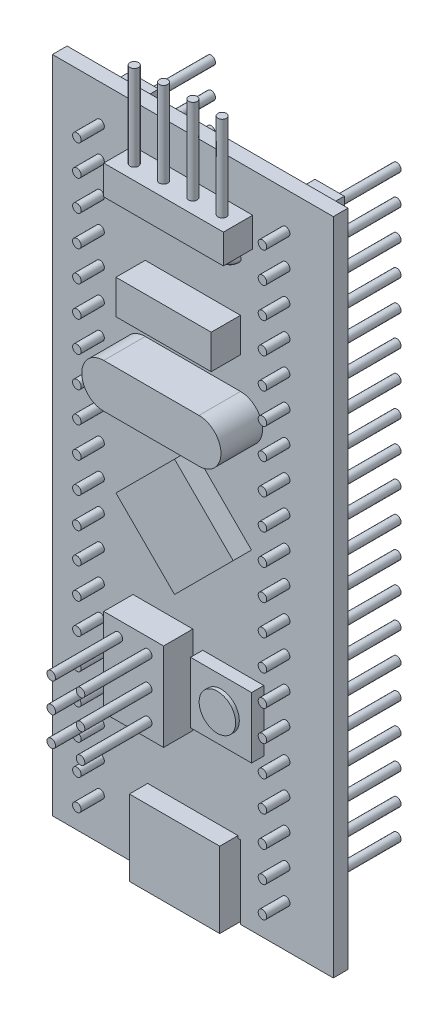
from build123d import *

# Parameters (mm, degrees)
SKETCH_1_W            = 23
SKETCH_1_H            = 54
EXTRUDE_1_DEPTH       = 1.2
SKETCH_2_W            = 2.4
SKETCH_2_H            = 50.6
EXTRUDE_2_DEPTH       = 2.4
SKETCH_3_R            = 0.35
EXTRUDE_3_DEPTH       = 5.5
SKETCH_4_W            = 9.8
SKETCH_4_H            = 2.4
SKETCH_4_W_2          = 4.9
SKETCH_4_H_2          = 7.2
SKETCH_4_W_3          = 7.8
SKETCH_4_H_3          = 2.8
EXTRUDE_4_DEPTH       = 2.4
SKETCH_5_R            = 0.35
EXTRUDE_5_DEPTH       = 7
SKETCH_6_R            = 0.35
SKETCH_7_R            = 0.35
EXTRUDE_6_DEPTH       = 5.5
SKETCH_8_W            = 7.4
SKETCH_8_H            = 6.2
EXTRUDE_7_DEPTH       = 1.5
EXTRUDE_8_DEPTH       = 3.4
SKETCH_10_W           = 5
SKETCH_10_H           = 5
EXTRUDE_9_DEPTH       = 1
SKETCH_11_R           = 1.495071924
EXTRUDE_10_DEPTH      = 0.3
CUT_EXTRUDE_1_DEPTH   = 6
IZIM1_W               = 6.9
IZIM1_H               = 1
KES_EKSTR_ZYON1_DEPTH = 5


with BuildPart() as part:
    # Эскиз1 → Бобышка-Вытянуть1 (new body)
    with BuildSketch(Plane.XY):
        with Locations((0.400091461, -3.870786517)):
            Rectangle(SKETCH_1_W, SKETCH_1_H)
    extrude(amount=EXTRUDE_1_DEPTH)

    # Эскиз2 → Бобышка-Вытянуть2 (add)
    with BuildSketch(Plane(origin=(0, 0, 0), x_dir=(-1, 0, 0), z_dir=(0, 0, -1))):
        with Locations((-8.000091461, -3.870786517)):
            Rectangle(SKETCH_2_W, SKETCH_2_H)
        with Locations((7.199908539, -3.870786517)):
            Rectangle(SKETCH_2_W, SKETCH_2_H)
    extrude(amount=EXTRUDE_2_DEPTH)

    # Эскиз3 → Бобышка-Вытянуть3 (add, symmetric)
    with BuildSketch(Plane(origin=(0, 0, -2.4), x_dir=(-1, 0, 0), z_dir=(0, 0, -1))):
        with Locations((-8.000091461, 20.132856753)):
            Circle(SKETCH_3_R)
        with Locations((7.199908539, 20.132856753)):
            Circle(SKETCH_3_R)
        with Locations((7.199908539, 17.632856753)):
            Circle(SKETCH_3_R)
        with Locations((7.199908539, 15.132856753)):
            Circle(SKETCH_3_R)
        with Locations((7.199908539, 12.632856753)):
            Circle(SKETCH_3_R)
        with Locations((7.199908539, 10.132856753)):
            Circle(SKETCH_3_R)
        with Locations((7.199908539, 7.632856753)):
            Circle(SKETCH_3_R)
        with Locations((7.199908539, 5.132856753)):
            Circle(SKETCH_3_R)
        with Locations((7.199908539, 2.632856753)):
            Circle(SKETCH_3_R)
        with Locations((7.199908539, 0.132856753)):
            Circle(SKETCH_3_R)
        with Locations((7.199908539, -2.367143247)):
            Circle(SKETCH_3_R)
        with Locations((7.199908539, -4.867143247)):
            Circle(SKETCH_3_R)
        with Locations((7.199908539, -7.367143247)):
            Circle(SKETCH_3_R)
        with Locations((7.199908539, -9.867143247)):
            Circle(SKETCH_3_R)
        with Locations((7.199908539, -12.367143247)):
            Circle(SKETCH_3_R)
        with Locations((7.199908539, -14.867143247)):
            Circle(SKETCH_3_R)
        with Locations((7.199908539, -17.367143247)):
            Circle(SKETCH_3_R)
        with Locations((7.199908539, -19.867143247)):
            Circle(SKETCH_3_R)
        with Locations((7.199908539, -22.367143247)):
            Circle(SKETCH_3_R)
        with Locations((7.199908539, -24.867143247)):
            Circle(SKETCH_3_R)
        with Locations((7.199908539, -27.367143247)):
            Circle(SKETCH_3_R)
        with Locations((-8.000091461, 17.632856753)):
            Circle(SKETCH_3_R)
        with Locations((-8.000091461, 15.132856753)):
            Circle(SKETCH_3_R)
        with Locations((-8.000091461, 12.632856753)):
            Circle(SKETCH_3_R)
        with Locations((-8.000091461, 10.132856753)):
            Circle(SKETCH_3_R)
        with Locations((-8.000091461, 7.632856753)):
            Circle(SKETCH_3_R)
        with Locations((-8.000091461, 5.132856753)):
            Circle(SKETCH_3_R)
        with Locations((-8.000091461, 2.632856753)):
            Circle(SKETCH_3_R)
        with Locations((-8.000091461, 0.132856753)):
            Circle(SKETCH_3_R)
        with Locations((-8.000091461, -2.367143247)):
            Circle(SKETCH_3_R)
        with Locations((-8.000091461, -4.867143247)):
            Circle(SKETCH_3_R)
        with Locations((-8.000091461, -7.367143247)):
            Circle(SKETCH_3_R)
        with Locations((-8.000091461, -9.867143247)):
            Circle(SKETCH_3_R)
        with Locations((-8.000091461, -12.367143247)):
            Circle(SKETCH_3_R)
        with Locations((-8.000091461, -14.867143247)):
            Circle(SKETCH_3_R)
        with Locations((-8.000091461, -17.367143247)):
            Circle(SKETCH_3_R)
        with Locations((-8.000091461, -19.867143247)):
            Circle(SKETCH_3_R)
        with Locations((-8.000091461, -22.367143247)):
            Circle(SKETCH_3_R)
        with Locations((-8.000091461, -24.867143247)):
            Circle(SKETCH_3_R)
        with Locations((-8.000091461, -27.367143247)):
            Circle(SKETCH_3_R)
    extrude(amount=EXTRUDE_3_DEPTH, both=True)

    # Эскиз4 → Бобышка-Вытянуть4 (add)
    with BuildSketch(Plane.XY.offset(1.2)):
        with Locations((0.400091461, 18.729213483)):
            Rectangle(SKETCH_4_W, SKETCH_4_H)
        with Locations((-2.049908539, -15.470786517)):
            Rectangle(SKETCH_4_W_2, SKETCH_4_H_2)
        with Locations((0.400091461, 10.929213483)):
            Rectangle(SKETCH_4_W_3, SKETCH_4_H_3)
    extrude(amount=EXTRUDE_4_DEPTH)

    # Эскиз5 → Бобышка-Вытянуть5 (add)
    with BuildSketch(Plane(origin=(0, 19.929213483, 0), x_dir=(1, 0, 0), z_dir=(0, 1, 0))):
        with Locations((-3.199908539, -2.4)):
            Circle(SKETCH_5_R)
        with Locations((-0.799908539, -2.4)):
            Circle(SKETCH_5_R)
        with Locations((1.600091461, -2.4)):
            Circle(SKETCH_5_R)
        with Locations((4.000091461, -2.4)):
            Circle(SKETCH_5_R)
    extrude(amount=EXTRUDE_5_DEPTH)

    # Эскиз6 → Повернуть1 (revolve)
    with BuildSketch(Plane.XZ.offset(-17.529213483), mode=Mode.PRIVATE) as revolve_1_sk:
        with Locations((-3.199908539, 2.4)):
            Circle(SKETCH_6_R)
        with Locations((-0.799908539, 2.4)):
            Circle(SKETCH_6_R)
        with Locations((1.600091461, 2.4)):
            Circle(SKETCH_6_R)
        with Locations((4.000091461, 2.4)):
            Circle(SKETCH_6_R)
    revolve(revolve_1_sk.sketch.rotate(Axis((-4.499908539, 17.529213483, 1.2), (1, 0, 0)), 45), axis=Axis((-4.499908539, 17.529213483, 1.2), (1, 0, 0)))

    # Эскиз7 → Бобышка-Вытянуть6 (add, symmetric)
    with BuildSketch(Plane.XY.offset(3.6)):
        with Locations((-3.299908539, -13.070786517)):
            Circle(SKETCH_7_R)
        with Locations((-0.899908539, -13.070786517)):
            Circle(SKETCH_7_R)
        with Locations((-0.899908539, -15.470786517)):
            Circle(SKETCH_7_R)
        with Locations((-0.899908539, -17.870786517)):
            Circle(SKETCH_7_R)
        with Locations((-3.299908539, -15.470786517)):
            Circle(SKETCH_7_R)
        with Locations((-3.299908539, -17.870786517)):
            Circle(SKETCH_7_R)
    extrude(amount=EXTRUDE_6_DEPTH, both=True)

    # Эскиз8 → Бобышка-Вытянуть7 (add)
    with BuildSketch(Plane.XY.offset(1.2)):
        Polygon((-4.399908539, -3.870786517), (0.400091461, 0.929213483), (5.200091461, -3.870786517), (0.400091461, -8.670786517), align=None)
        with Locations((0.400091461, -27.770786517)):
            Rectangle(SKETCH_8_W, SKETCH_8_H)
    extrude(amount=EXTRUDE_7_DEPTH)

    # Эскиз9 → Бобышка-Вытянуть8 (add)
    with BuildSketch(Plane.XY.offset(1.2)):
        with BuildLine():
            Line((-3.499908539, 6.929213483), (4.300091461, 6.929213483))
            ThreePointArc((4.300091461, 6.929213483), (6.100091461, 5.129213483), (4.300091461, 3.329213483))
            Line((4.300091461, 3.329213483), (-3.499908539, 3.329213483))
            ThreePointArc((-3.499908539, 3.329213483), (-5.299908539, 5.129213483), (-3.499908539, 6.929213483))
        make_face()
    extrude(amount=EXTRUDE_8_DEPTH)

    # Эскиз10 → Бобышка-Вытянуть9 (add)
    with BuildSketch(Plane.XY.offset(1.2)):
        with Locations((3.709299321, -15.470786517)):
            Rectangle(SKETCH_10_W, SKETCH_10_H)
    extrude(amount=EXTRUDE_9_DEPTH)

    # Эскиз11 → Бобышка-Вытянуть10 (add)
    with BuildSketch(Plane.XY.offset(2.2)):
        with Locations((3.709299321, -15.470786517)):
            Circle(SKETCH_11_R)
    extrude(amount=EXTRUDE_10_DEPTH)

    # Эскиз12 → Вырез-Вытянуть1 (cut)
    with BuildSketch(Plane.XZ.offset(30.870786517)):
        Polygon((-3.48398033, 1.2), (-3.48398033, 0), (4.284163251, 0), (4.284163251, 1.2), (4.100091461, 1.2), (4.100091461, 0.727005887), (3.520830502, 0.185516694), (-2.720647581, 0.185516694), (-3.299908539, 0.727005887), (-3.299908539, 1.2), align=None)
    extrude(amount=-CUT_EXTRUDE_1_DEPTH, mode=Mode.SUBTRACT)

    # Çizim1 → Kes-Ekstrüzyon1 (cut)
    with BuildSketch(Plane.XZ.offset(30.870786517)):
        Polygon((-3.049908539, 0.985516694), (-2.533402927, 0.485516694), (3.333585849, 0.485516694), (3.850091461, 0.985516694), align=None)
        with Locations((0.400091461, 1.885516694)):
            Rectangle(IZIM1_W, IZIM1_H)
    extrude(amount=-KES_EKSTR_ZYON1_DEPTH, mode=Mode.SUBTRACT)


solid = part.part
